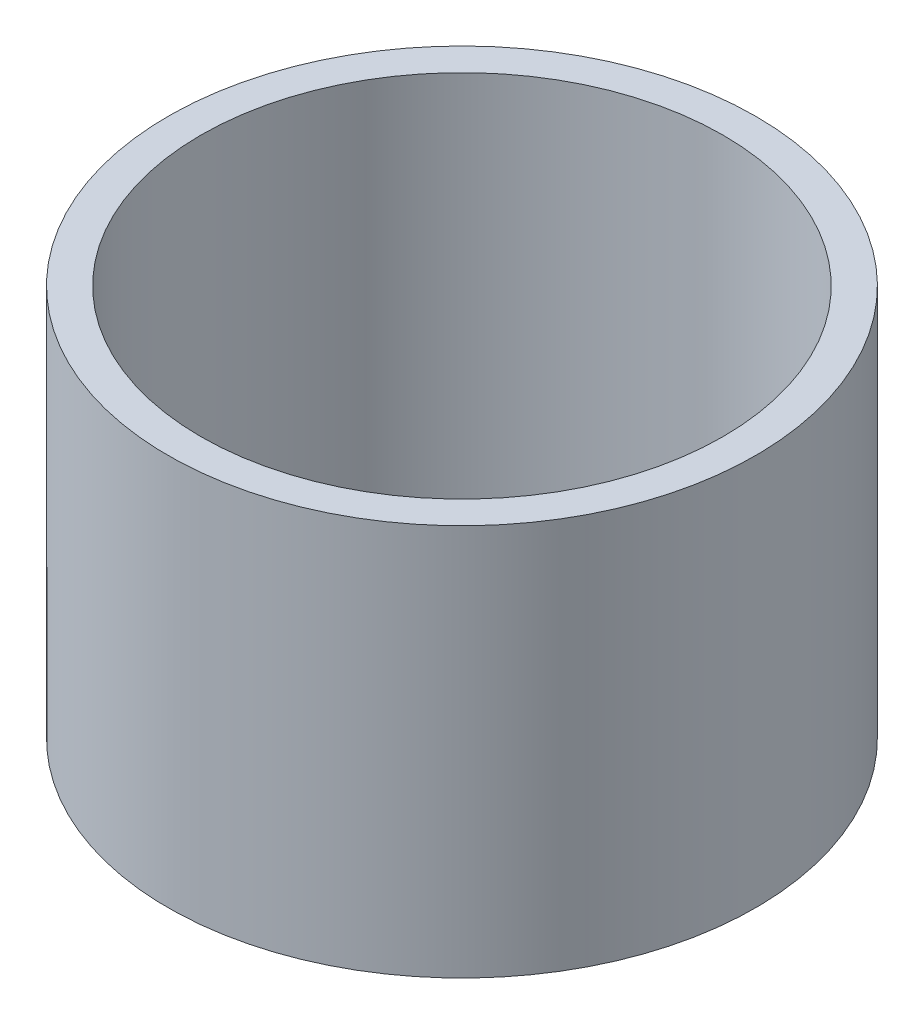
from build123d import *

# Parameters (mm, degrees)
SKETCH1_R           = 14.2875
SKETCH1_R_2         = 12.7
BOSS_EXTRUDE1_DEPTH = 19.05


with BuildPart() as part:
    # Sketch1 → Boss-Extrude1 (new body)
    with BuildSketch(Plane(origin=(0, 0, 0), x_dir=(1, 0, 0), z_dir=(0, 1, 0))):
        with Locations(Location((0, 0, 0), (0, 0, 90))):
            Circle(SKETCH1_R)
        with Locations(Location((0, 0, 0), (0, 0, 90))):
            Circle(SKETCH1_R_2, mode=Mode.SUBTRACT)
    extrude(amount=BOSS_EXTRUDE1_DEPTH)


solid = part.part
